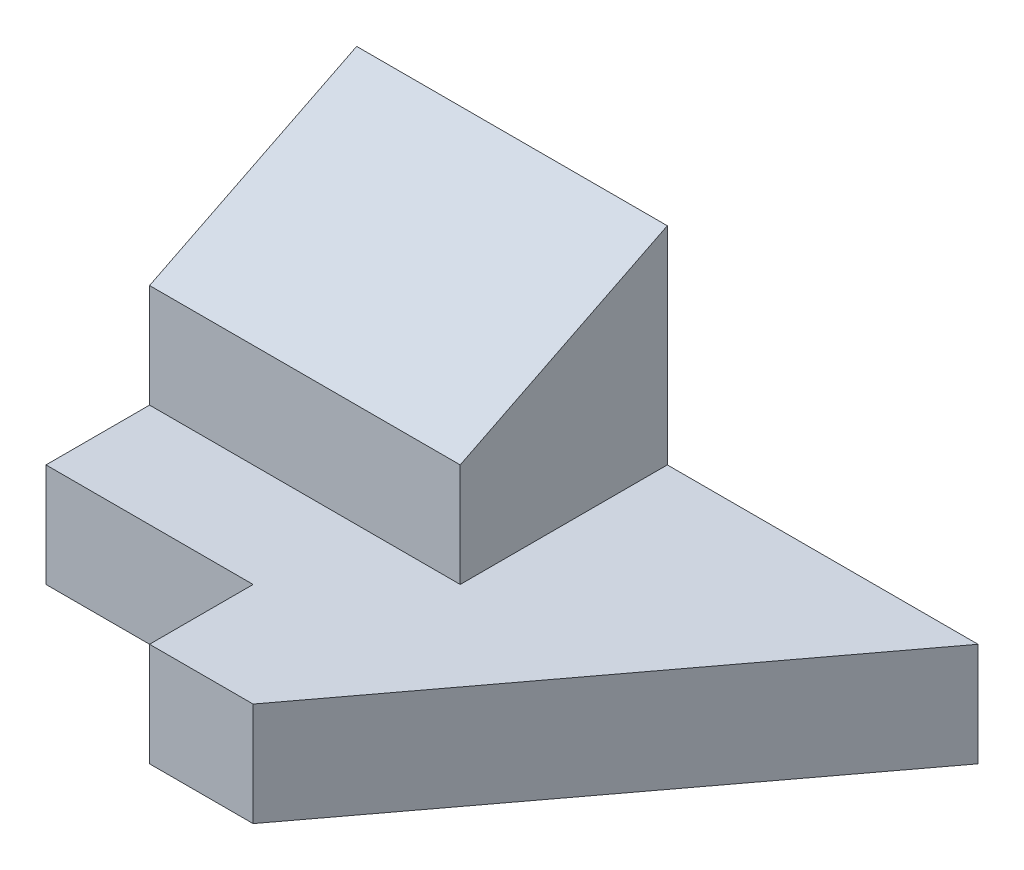
from build123d import *

# Parameters (mm, degrees)
BOSS_EXTRUDE1_DEPTH = 10
BOSS_EXTRUDE2_DEPTH = 30


with BuildPart() as part:
    # Sketch1 → Boss-Extrude1 (new body)
    with BuildSketch(Plane(origin=(0, 0, 0), x_dir=(1, 0, 0), z_dir=(0, 1, 0))):
        Polygon((-38.831168831, 33.636363636), (-38.831168831, 3.636363636), (-18.831168831, 3.636363636), (-18.831168831, -6.363636364), (-8.831168831, -6.363636364), (21.168831169, 33.636363636), align=None)
    extrude(amount=BOSS_EXTRUDE1_DEPTH)

    # Sketch2 → Boss-Extrude2 (add)
    with BuildSketch(Plane.ZY.offset(38.831168831)):
        Polygon((-33.636363636, 10), (-33.636363636, 30), (-13.636363636, 20), (-13.636363636, 10), align=None)
    extrude(amount=-BOSS_EXTRUDE2_DEPTH)


solid = part.part
